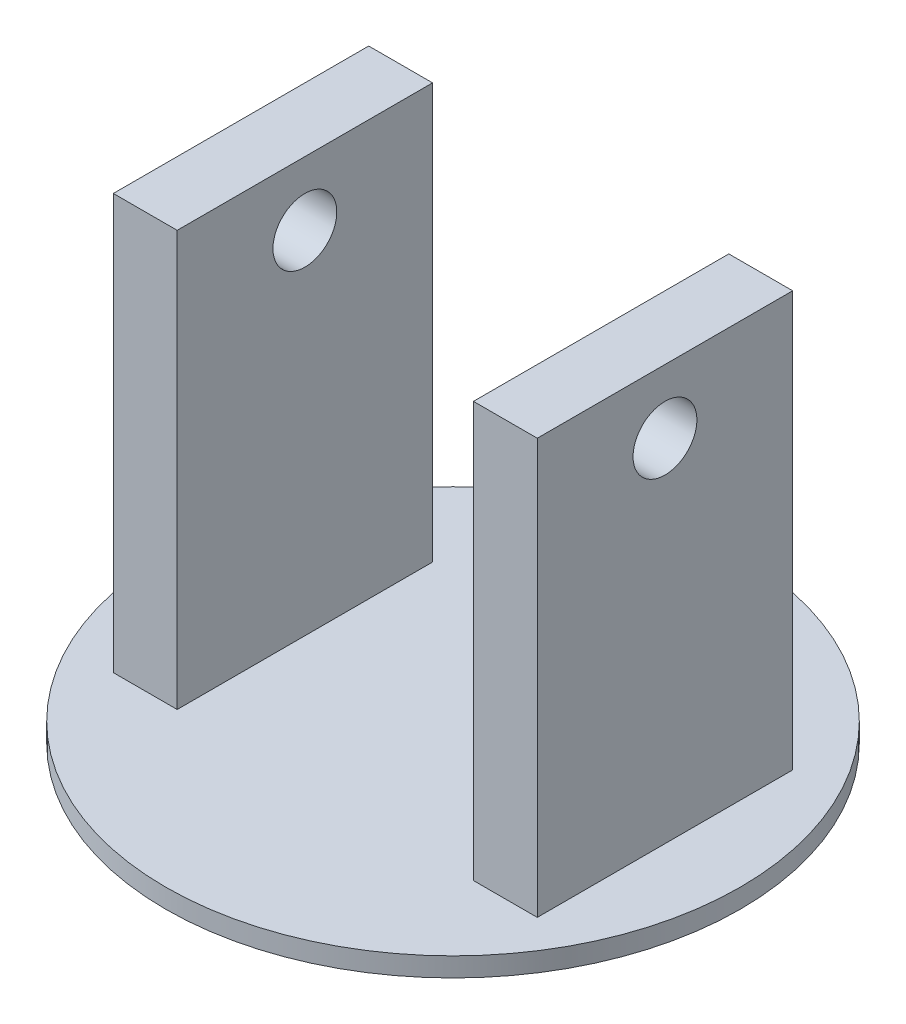
from build123d import *

# Parameters (mm, degrees)
SKETCH1_R           = 45
BOSS_EXTRUDE1_DEPTH = 3
SKETCH2_W           = 10
SKETCH2_H           = 40
BOSS_EXTRUDE2_DEPTH = 65
CUT_EXTRUDE1_REACH  = 114.979
SKETCH3_R           = 5


with BuildPart() as part:
    # Sketch1 → Boss-Extrude1 (new body)
    with BuildSketch(Plane(origin=(0, 0, 0), x_dir=(1, 0, 0), z_dir=(0, 1, 0))):
        with Locations(Location((0, 0, 0), (0, 0, 270))):
            Circle(SKETCH1_R)
    extrude(amount=BOSS_EXTRUDE1_DEPTH)

    # Sketch2 → Boss-Extrude2 (add)
    with BuildSketch(Plane(origin=(0, 3, 0), x_dir=(1, 0, 0), z_dir=(0, 1, 0))):
        with Locations((-28.200807343, 0)):
            Rectangle(SKETCH2_W, SKETCH2_H)
        with Locations((28.200807343, 0)):
            Rectangle(SKETCH2_W, SKETCH2_H)
    extrude(amount=BOSS_EXTRUDE2_DEPTH)

    # Cut-Extrude1: up to this face of the body (flat: up to its plane)
    cut_extrude1_end = Plane(part.part.faces().sort_by_distance((33.200807343, 35.5, 0))[0])
    # Sketch3 → Cut-Extrude1 (cut, up to the picked face)
    with BuildSketch(Plane.ZY.offset(33.200807343), mode=Mode.PRIVATE) as cut_extrude1_sk1:
        with Locations((0, 58)):
            Circle(SKETCH3_R)
    cut_extrude1_tool1 = split(extrude(cut_extrude1_sk1.sketch, amount=-CUT_EXTRUDE1_REACH, mode=Mode.PRIVATE), bisect_by=cut_extrude1_end, keep=Keep.BOTH, mode=Mode.PRIVATE)
    add(cut_extrude1_tool1.solids().sort_by(Axis((-33.200807, 58, 0), (1, 0, 0)))[0], mode=Mode.SUBTRACT)


solid = part.part
